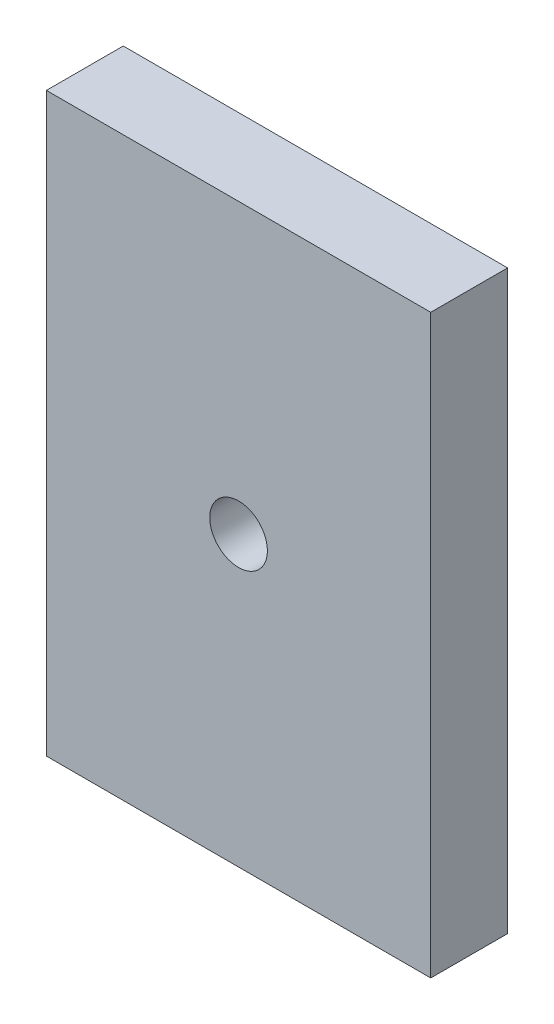
from build123d import *

# Parameters (mm, degrees)
SKETCH1_W           = 20
SKETCH1_H           = 30
BOSS_EXTRUDE1_DEPTH = 4
SKETCH2_R           = 1.5
CUT_EXTRUDE1_DEPTH  = 19.466185313


with BuildPart() as part:
    # Sketch1 → Boss-Extrude1 (new body)
    with BuildSketch(Plane.XY):
        Rectangle(SKETCH1_W, SKETCH1_H)
    extrude(amount=BOSS_EXTRUDE1_DEPTH)

    # Sketch2 → Cut-Extrude1 (cut, through all)
    with BuildSketch(Plane.XY.offset(4)):
        Circle(SKETCH2_R)
    extrude(amount=-CUT_EXTRUDE1_DEPTH, mode=Mode.SUBTRACT)


solid = part.part
